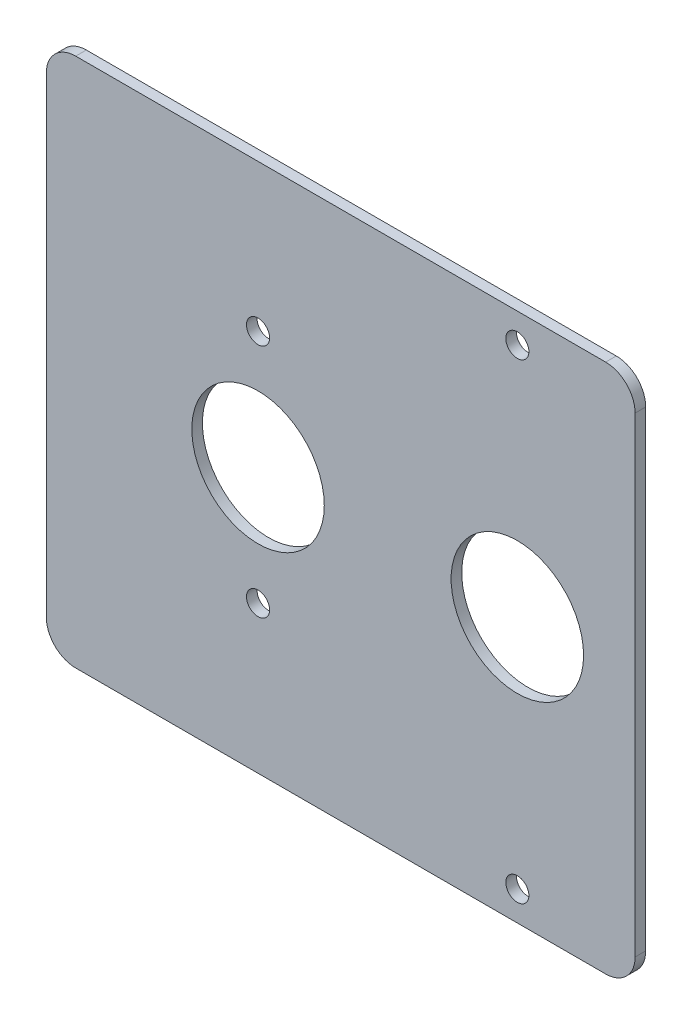
from build123d import *

# Parameters (mm, degrees)
SKETCH1_W           = 127
SKETCH1_H           = 114.3
SKETCH1_R           = 2.4892
SKETCH1_R_2         = 14.2875
BOSS_EXTRUDE1_DEPTH = 1.143
FILLET1_R           = 6.35


with BuildPart() as part:
    # Sketch1 → Boss-Extrude1 (new, symmetric)
    with BuildSketch(Plane.XY):
        with Locations((63.5, 57.15)):
            Rectangle(SKETCH1_W, SKETCH1_H)
        with Locations((45.6692, 82.55)):
            Circle(SKETCH1_R, mode=Mode.SUBTRACT)
        with Locations((45.6692, 57.15)):
            Circle(SKETCH1_R_2, mode=Mode.SUBTRACT)
        with Locations((45.6692, 31.75)):
            Circle(SKETCH1_R, mode=Mode.SUBTRACT)
        with Locations((101.6, 107.95)):
            Circle(SKETCH1_R, mode=Mode.SUBTRACT)
        with Locations((101.6, 57.15)):
            Circle(SKETCH1_R_2, mode=Mode.SUBTRACT)
        with Locations((101.6, 6.35)):
            Circle(SKETCH1_R, mode=Mode.SUBTRACT)
    extrude(amount=BOSS_EXTRUDE1_DEPTH, both=True)

    # Fillet1
    fillet1_edges = [part.edges().sort_by_distance(p)[0] for p in [
        (0, 114.3, 0),
        (127, 114.3, 0),
        (127, 0, 0),
        (0, 0, 0),
    ]]
    fillet(fillet1_edges, radius=FILLET1_R)


solid = part.part
